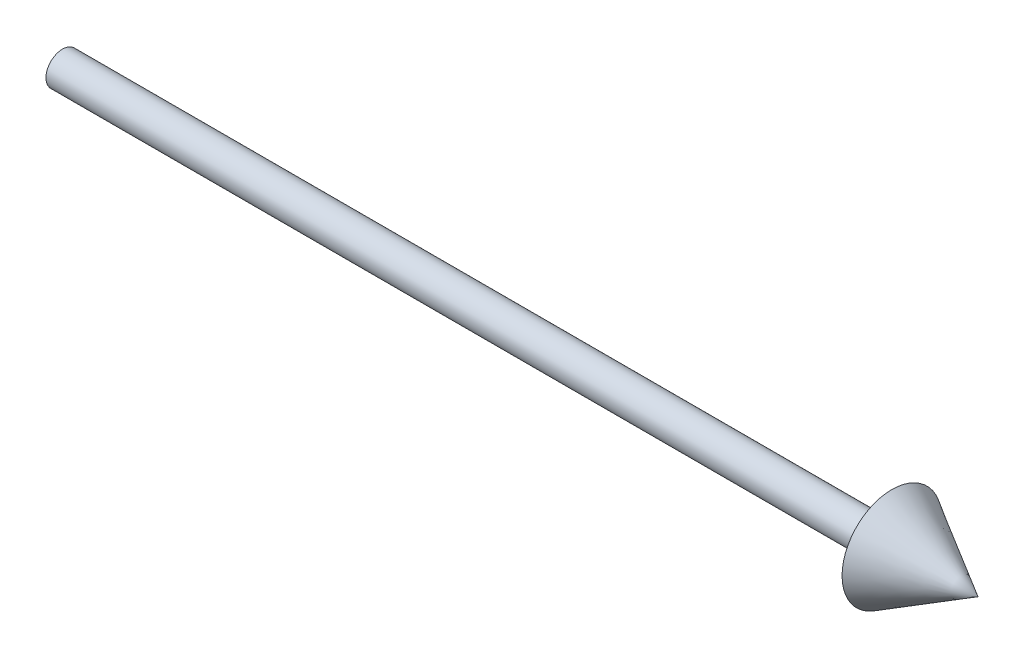
from build123d import *

# Parameters (mm, degrees)
SKETCH1_R           = 1
BOSS_EXTRUDE1_DEPTH = 50


with BuildPart() as part:
    # Sketch1 → Boss-Extrude1 (new body)
    with BuildSketch(Plane(origin=(0, 0, 0), x_dir=(0, 0, -1), z_dir=(1, 0, 0))):
        Circle(SKETCH1_R)
    extrude(amount=BOSS_EXTRUDE1_DEPTH)


with BuildPart() as body_2:
    # Sketch4 → Revolve1 (revolve)
    with BuildSketch(Plane(origin=(0, 0, 0), x_dir=(1, 0, 0), z_dir=(0, 1, 0)), mode=Mode.PRIVATE) as revolve1_sk:
        Polygon((50, 0), (50, 3), (55.196152423, 0), align=None)
    revolve(revolve1_sk.sketch.rotate(Axis((50, 0, 0), (1, 0, 0)), 180), axis=Axis((50, 0, 0), (1, 0, 0)))


solid = Compound([part.part, body_2.part])
